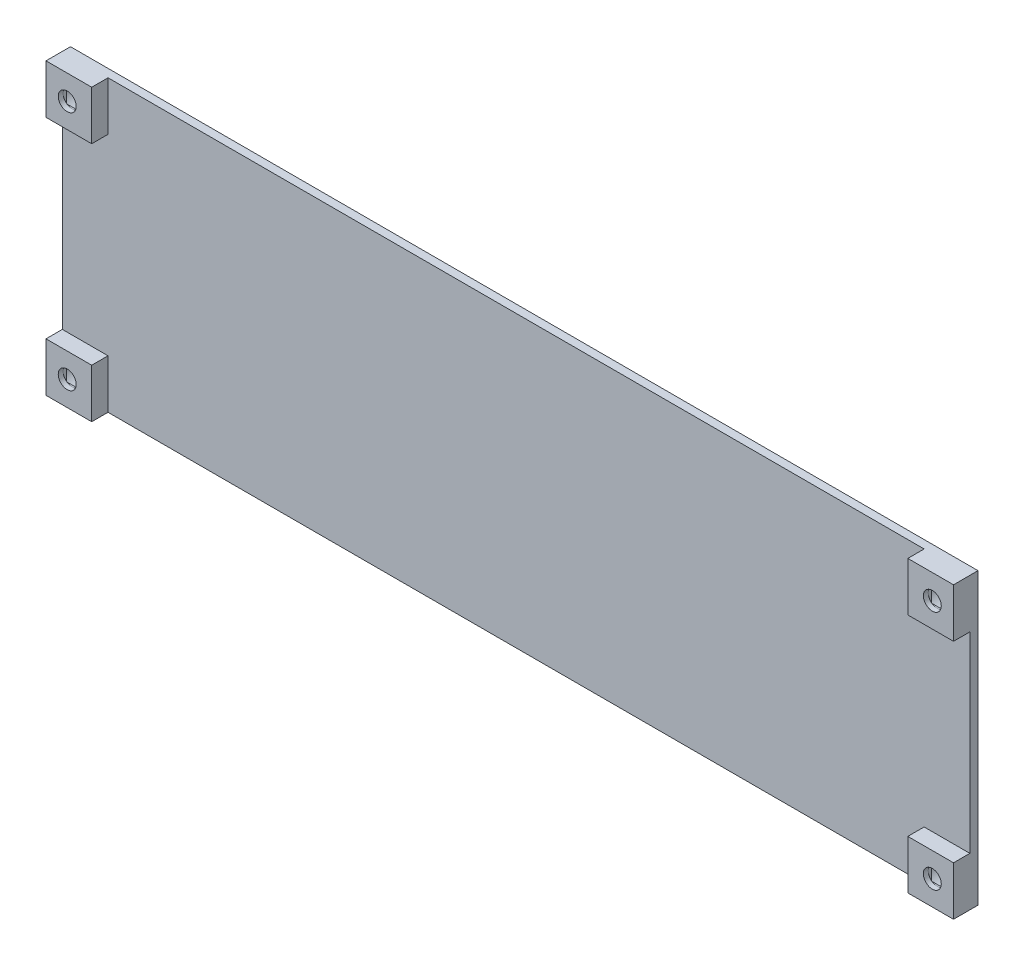
from build123d import *
from build123d.topology import SkipClean

# Parameters (mm, degrees)
SKETCH1_W               = 112
SKETCH1_H               = 35.5
BOSS_EXTRUDE1_DEPTH     = 1
SKETCH2_W               = 6
SKETCH2_H               = 6
BOSS_EXTRUDE2_DEPTH     = 2
SKETCH3_R               = 1.1
CUT_EXTRUDE1_DEPTH      = 59.822295943
SKETCH4_R               = 2
CUT_EXTRUDE2_DEPTH      = 2
CUT_EXTRUDE3_DEPTH      = 0.2
SKETCH6_W               = 2.2
SKETCH6_H               = 2.2
CUT_EXTRUDE4_DEPTH      = 0.2
MIRROR2_COPY_1_DEPTH    = 0.2
MIRROR2_COPY_2_SKETCH_W = 2.2
MIRROR2_COPY_2_SKETCH_H = 2.2
MIRROR2_COPY_2_DEPTH    = 0.2
SKETCH7_W               = 0.4
SKETCH7_H               = 35.5
CUT_EXTRUDE5_DEPTH      = 59.822295943
CUT_EXTRUDE6_DEPTH      = 0.2
BOSS_EXTRUDE3_DEPTH     = 0.2


with BuildPart() as part:
    # Sketch1 → Boss-Extrude1 (new body)
    with BuildSketch(Plane.XY):
        Rectangle(SKETCH1_W, SKETCH1_H)
    extrude(amount=BOSS_EXTRUDE1_DEPTH)

    # Sketch2 → Boss-Extrude2 (add)
    with BuildSketch(Plane.XY.offset(1)):
        with Locations((-53, 14.75)):
            Rectangle(SKETCH2_W, SKETCH2_H)
        with Locations((-53, -14.75)):
            Rectangle(SKETCH2_W, SKETCH2_H)
        with Locations((53, -14.75)):
            Rectangle(SKETCH2_W, SKETCH2_H)
        with Locations((53, 14.75)):
            Rectangle(SKETCH2_W, SKETCH2_H)
    extrude(amount=BOSS_EXTRUDE2_DEPTH)

    # Sketch3 → Cut-Extrude1 (cut, through all)
    with BuildSketch(Plane.XY.offset(3)):
        with Locations((-53, 14.75)):
            Circle(SKETCH3_R)
        with Locations(Location((-53, -14.75, 0), (0, 0, 180))):
            Circle(SKETCH3_R)
        with Locations((53, -14.75)):
            Circle(SKETCH3_R)
        with Locations(Location((53, 14.75, 0), (0, 0, 180))):
            Circle(SKETCH3_R)
    extrude(amount=-CUT_EXTRUDE1_DEPTH, mode=Mode.SUBTRACT)

    # Sketch4 → Cut-Extrude2 (cut)
    with BuildSketch(Plane(origin=(0, 0, 0), x_dir=(-1, 0, 0), z_dir=(0, 0, -1))):
        with Locations((-53, 14.75)):
            Circle(SKETCH4_R)
        with Locations((-53, -14.75)):
            Circle(SKETCH4_R)
        with Locations((53, 14.75)):
            Circle(SKETCH4_R)
        with Locations((53, -14.75)):
            Circle(SKETCH4_R)
    extrude(amount=-CUT_EXTRUDE2_DEPTH, mode=Mode.SUBTRACT)

    # Sketch5 → Cut-Extrude3 (cut)
    with SkipClean():  # the faces are left unmerged after this step: merging them gives an invalid solid
        with BuildSketch(Plane(origin=(0, 0, 2), x_dir=(-1, 0, 0), z_dir=(0, 0, -1))):
            with BuildLine():
                Line((-54.1, 13.079670691), (-54.1, 16.420329309))
                ThreePointArc((-54.1, 16.420329309), (-53, 16.75), (-51.9, 16.420329309))
                Line((-51.9, 16.420329309), (-51.9, 13.079670691))
                ThreePointArc((-51.9, 13.079670691), (-53, 12.75), (-54.1, 13.079670691))
            make_face()
        cut_extrude3 = extrude(amount=-CUT_EXTRUDE3_DEPTH, mode=Mode.SUBTRACT)

    # Sketch6 → Cut-Extrude4 (cut)
    with SkipClean():  # the faces are left unmerged after this step: merging them gives an invalid solid
        with BuildSketch(Plane(origin=(0, 0, 2.2), x_dir=(-1, 0, 0), z_dir=(0, 0, -1))):
            with Locations((-53, 14.75)):
                Rectangle(SKETCH6_W, SKETCH6_H)
        cut_extrude4 = extrude(amount=-CUT_EXTRUDE4_DEPTH, mode=Mode.SUBTRACT)

    # Mirror1: Cut-Extrude3, Cut-Extrude4 across plane
    with SkipClean():  # the faces are left unmerged after this step: merging them gives an invalid solid
        add(cut_extrude3.mirror(Plane(origin=(0, 0, 0), x_dir=(0, 0, 1), z_dir=(1, 0, 0))), mode=Mode.SUBTRACT)
        add(cut_extrude4.mirror(Plane(origin=(0, 0, 0), x_dir=(0, 0, 1), z_dir=(1, 0, 0))), mode=Mode.SUBTRACT)

    # Mirror2: Cut-Extrude3, Cut-Extrude4 across plane
    with SkipClean():  # the faces are left unmerged after this step: merging them gives an invalid solid
        add(cut_extrude3.mirror(Plane.ZX), mode=Mode.SUBTRACT)
        add(cut_extrude4.mirror(Plane.ZX), mode=Mode.SUBTRACT)

    # Mirror2 copy 1 sketch → Mirror2 copy 1 (cut)
    with SkipClean():  # the faces are left unmerged after this step: merging them gives an invalid solid
        with BuildSketch(Plane(origin=(0, 0, 2), x_dir=(1, 0, 0), z_dir=(0, 0, -1))):
            with BuildLine():
                Line((-54.1, 13.079670691), (-54.1, 16.420329309))
                ThreePointArc((-54.1, 16.420329309), (-53, 16.75), (-51.9, 16.420329309))
                Line((-51.9, 16.420329309), (-51.9, 13.079670691))
                ThreePointArc((-51.9, 13.079670691), (-53, 12.75), (-54.1, 13.079670691))
            make_face()
        extrude(amount=-MIRROR2_COPY_1_DEPTH, mode=Mode.SUBTRACT)

    # Mirror2 copy 2 sketch → Mirror2 copy 2 (cut)
    with SkipClean():  # the faces are left unmerged after this step: merging them gives an invalid solid
        with BuildSketch(Plane(origin=(0, 0, 2.2), x_dir=(1, 0, 0), z_dir=(0, 0, -1))):
            with Locations((-53, 14.75)):
                Rectangle(MIRROR2_COPY_2_SKETCH_W, MIRROR2_COPY_2_SKETCH_H)
        extrude(amount=-MIRROR2_COPY_2_DEPTH, mode=Mode.SUBTRACT)

    # Sketch7 → Cut-Extrude5 (cut, through all)
    with SkipClean():  # the faces are left unmerged after this step: merging them gives an invalid solid
        with BuildSketch(Plane(origin=(0, 0, 0), x_dir=(-1, 0, 0), z_dir=(0, 0, -1))):
            with Locations((-55.8, 0)):
                Rectangle(SKETCH7_W, SKETCH7_H)
            with Locations((55.8, 0)):
                Rectangle(SKETCH7_W, SKETCH7_H)
        extrude(amount=-CUT_EXTRUDE5_DEPTH, mode=Mode.SUBTRACT)

    # Sketch8 → Cut-Extrude6 (cut)
    with SkipClean():  # the faces are left unmerged after this step: merging them gives an invalid solid
        with BuildSketch(Plane(origin=(0, 0, 0), x_dir=(-1, 0, 0), z_dir=(0, 0, -1))):
            with BuildLine():
                add(Edge.make_bspline(
                    [(3.593304154, -0.141304348), (3.782621126, -0.21609679), (4.155384016, -0.363362229), (4.685515758, -0.626747088), (5.185947538, -0.905885584), (5.64762688, -1.218217721), (6.073537447, -1.556430019), (6.469205887, -1.917081418), (6.830733456, -2.303886675), (7.150261717, -2.721840268), (7.441647233, -3.159326761), (7.689864448, -3.625237823), (7.900251586, -4.116468632), (8.080229909, -4.630901051), (8.210614728, -5.174622397), (8.302766839, -5.742607998), (8.368405304, -6.33556514), (8.372329652, -6.740853659), (8.374331822, -6.947628458)],
                    knots=[0, 0, 0, 0, 1.093801908, 2.153683087, 3.179432455, 4.172254168, 5.14632992, 6.100828362, 7.048036701, 7.988159892, 8.92597937, 9.870901268, 10.821373797, 11.796609674, 12.797077128, 13.822443002, 14.889028699, 16, 16, 16, 16], degree=3))
                add(Edge.make_bspline(
                    [(8.374331822, -6.947628458), (8.369617098, -7.159874537), (8.360291338, -7.57969888), (8.300324817, -8.197806983), (8.194733728, -8.791293997), (8.048888883, -9.36040671), (7.869483952, -9.908234796), (7.640301957, -10.431799066), (7.36793305, -10.93042347), (6.954774121, -11.562312704), (6.359955282, -12.297521454), (5.509755968, -13.057132683), (4.559566498, -13.724773899), (3.493239771, -14.259339295), (2.346434991, -14.686639464), (1.130353153, -14.987624243), (-0.145194358, -15.1762545), (-1.015511649, -15.198139734), (-1.458869759, -15.209288538)],
                    knots=[0, 0, 0, 0, 0.707145738, 1.398739603, 2.066581228, 2.713453321, 3.354755146, 3.98497847, 4.614722218, 5.245394814, 6.49888604, 7.751849909, 9.032125326, 10.356849696, 11.71410182, 13.10173286, 14.52356117, 16, 16, 16, 16], degree=3))
                add(Edge.make_bspline(
                    [(-1.458869759, -15.209288538), (-1.744958781, -15.203813836), (-2.30713011, -15.193055926), (-3.136936656, -15.112782491), (-3.937602925, -14.987484913), (-4.712974644, -14.810073208), (-5.458395872, -14.578429489), (-6.176620953, -14.292772724), (-6.869796958, -13.964150927), (-7.525992313, -13.57472691), (-8.148937895, -13.144295978), (-8.72665093, -12.662492831), (-9.252519915, -12.127346527), (-9.736107162, -11.551722459), (-10.169120142, -10.929195989), (-10.551751326, -10.259832767), (-10.892323356, -9.544423924), (-11.076577635, -9.040960957), (-11.17033221, -8.784782609)],
                    knots=[0, 0, 0, 0, 1.098325863, 2.1582349, 3.198005682, 4.208194407, 5.209505907, 6.191929481, 7.173918982, 8.151711052, 9.118333295, 10.078630107, 11.035158777, 11.99545559, 12.962077833, 13.94243145, 14.953042137, 16, 16, 16, 16], degree=3))
                Line((-11.17033221, -8.784782609), (-6.771122724, -6.261462451))
                add(Edge.make_bspline(
                    [(-6.771122724, -6.261462451), (-6.662790789, -6.575499428), (-6.452733779, -7.184421148), (-5.986980422, -8.00331549), (-5.42677602, -8.707224356), (-4.76426148, -9.276785955), (-4.030664245, -9.721254951), (-3.247198887, -10.036969299), (-2.423045904, -10.243038616), (-1.856679743, -10.263132765), (-1.569541696, -10.273320158)],
                    knots=[0, 0, 0, 0, 1.126000664, 2.183329707, 3.181063205, 4.166811363, 5.133552749, 6.080305486, 7.026747408, 8, 8, 8, 8], degree=3))
                add(Edge.make_bspline(
                    [(-1.569541696, -10.273320158), (-1.293528292, -10.262916392), (-0.75674179, -10.242683312), (0.011774593, -10.04827643), (0.710218139, -9.735791902), (1.226651919, -9.373732968), (1.590117231, -9.028786808), (1.824580985, -8.739426974), (2.038466221, -8.434364103), (2.192448665, -8.093861), (2.323532377, -7.735710833), (2.416606971, -7.353641849), (2.473290352, -6.947502543), (2.478425897, -6.66929492), (2.481051189, -6.527075099)],
                    knots=[0, 0, 0, 0, 1.598918806, 3.109552001, 4.565636335, 6.017506463, 6.744131438, 7.466250292, 8.175648169, 8.898480383, 9.626286544, 10.386797627, 11.175330457, 12, 12, 12, 12], degree=3))
                add(Edge.make_bspline(
                    [(2.481051189, -6.527075099), (2.477784077, -6.369925321), (2.471443035, -6.064917989), (2.394446074, -5.626135359), (2.287153924, -5.215487733), (2.124480759, -4.835559265), (1.913602621, -4.485820511), (1.655210256, -4.166970362), (1.353161236, -3.878584621), (1.009833706, -3.613733827), (0.609443123, -3.397424598), (0.173538047, -3.195154574), (-0.310928832, -3.0307386), (-0.840724903, -2.89909922), (-1.417556197, -2.795200862), (-2.03998604, -2.718061406), (-2.708852681, -2.674845077), (-3.16869027, -2.668110322), (-3.406695846, -2.664624506)],
                    knots=[0, 0, 0, 0, 0.944462577, 1.833079328, 2.673167542, 3.49367128, 4.310262101, 5.123224284, 5.955282357, 6.818799209, 7.723285984, 8.686859241, 9.708272632, 10.795808816, 11.96921428, 13.232995045, 14.567836505, 16, 16, 16, 16], degree=3))
                Line((-3.406695846, -2.664624506), (-4.441478455, -2.664624506))
                Line((-4.441478455, -2.664624506), (-4.441478455, 1.92826087))
                Line((-4.441478455, 1.92826087), (-2.947407309, 1.92826087))
                add(Edge.make_bspline(
                    [(-2.947407309, 1.92826087), (-2.770200556, 1.931224892), (-2.426115345, 1.936980184), (-1.926768722, 1.987730452), (-1.459856241, 2.068580846), (-1.026322011, 2.187877679), (-0.618740583, 2.326750312), (-0.249070768, 2.513251024), (0.095177608, 2.721609727), (0.491655783, 3.053107658), (0.917893311, 3.512908516), (1.292609996, 4.147559623), (1.525862097, 4.850725208), (1.550078733, 5.344364395), (1.562474114, 5.597035573)],
                    knots=[0, 0, 0, 0, 0.975719931, 1.894571129, 2.761408257, 3.582009645, 4.369233952, 5.127953448, 5.858044713, 6.579962393, 7.967855396, 9.288498116, 10.612106997, 12, 12, 12, 12], degree=3))
                add(Edge.make_bspline(
                    [(1.562474114, 5.597035573), (1.551345735, 5.828826756), (1.529887253, 6.275781987), (1.348607061, 6.911017245), (1.043871718, 7.473784148), (0.616574254, 7.949100059), (0.103576147, 8.339578943), (-0.495765515, 8.613584334), (-1.163578233, 8.784001697), (-1.634862497, 8.802471115), (-1.879423119, 8.812055336)],
                    knots=[0, 0, 0, 0, 1.049106038, 2.022956289, 2.965771539, 3.925305, 4.898473145, 5.86721393, 6.893246548, 8, 8, 8, 8], degree=3))
                add(Edge.make_bspline(
                    [(-1.879423119, 8.812055336), (-2.146236804, 8.799551721), (-2.666992494, 8.775147692), (-3.421676425, 8.575004289), (-4.115309826, 8.236346809), (-4.751994036, 7.771570515), (-5.320160334, 7.180913011), (-5.817171816, 6.475092644), (-6.254085501, 5.662133996), (-6.470672893, 5.065370136), (-6.582980431, 4.755928854)],
                    knots=[0, 0, 0, 0, 0.958674045, 1.871099546, 2.785019286, 3.720572554, 4.691768083, 5.719060512, 6.81725941, 8, 8, 8, 8], degree=3))
                Line((-6.582980431, 4.755928854), (-10.788514028, 7.168577075))
                add(Edge.make_bspline(
                    [(-10.788514028, 7.168577075), (-10.702610749, 7.430337373), (-10.533734046, 7.944930257), (-10.207233495, 8.677026686), (-9.843858882, 9.364707002), (-9.434039168, 10.005780441), (-8.970889793, 10.593420757), (-8.46588835, 11.139799467), (-7.911890414, 11.637804023), (-7.31287544, 12.086465342), (-6.676197247, 12.482925665), (-6.011638779, 12.833532012), (-5.316033585, 13.129146414), (-4.590722923, 13.363485106), (-3.839256936, 13.555482677), (-3.058159077, 13.686164451), (-2.248095482, 13.764483886), (-1.698835122, 13.775589958), (-1.420134581, 13.781225296)],
                    knots=[0, 0, 0, 0, 1.069361373, 2.102250634, 3.108563351, 4.088233382, 5.052698257, 6.010756429, 6.974555926, 7.941677734, 8.913669322, 9.88460434, 10.857255703, 11.844986206, 12.842308434, 13.866941532, 14.917663476, 16, 16, 16, 16], degree=3))
                add(Edge.make_bspline(
                    [(-1.420134581, 13.781225296), (-0.993390697, 13.770030298), (-0.159791776, 13.748162055), (1.049119511, 13.563799794), (2.180185152, 13.258384634), (3.226323657, 12.835313493), (4.17504469, 12.296785661), (5.023739252, 11.66282296), (5.753080601, 10.920753444), (6.364972617, 10.085149366), (6.854883197, 9.169690853), (7.2072239, 8.178206435), (7.413420007, 7.118057649), (7.441457409, 6.389240524), (7.455754747, 6.017588933)],
                    knots=[0, 0, 0, 0, 1.159430369, 2.264824269, 3.314418978, 4.33759029, 5.323224119, 6.271782723, 7.207710299, 8.140274846, 9.077798985, 10.019723069, 10.990181423, 12, 12, 12, 12], degree=3))
                add(Edge.make_bspline(
                    [(7.455754747, 6.017588933), (7.444710845, 5.671836753), (7.423225669, 4.999198899), (7.23727836, 4.023955261), (6.926596178, 3.122491867), (6.497610949, 2.291853275), (5.945170486, 1.545932072), (5.275288053, 0.884297461), (4.489345527, 0.30687267), (3.897089049, 0.010641101), (3.593304154, -0.141304348)],
                    knots=[0, 0, 0, 0, 1.073985575, 2.089367457, 3.07209394, 4.028597903, 4.983795072, 5.944619371, 6.945737847, 8, 8, 8, 8], degree=3))
            make_face()
        extrude(amount=-CUT_EXTRUDE6_DEPTH, mode=Mode.SUBTRACT)

    # Sketch9 → Boss-Extrude3 (add)
    with SkipClean():  # the faces are left unmerged after this step: merging them gives an invalid solid
        with BuildSketch(Plane(origin=(0, 0, 0.2), x_dir=(-1, 0, 0), z_dir=(0, 0, -1))):
            with BuildLine():
                Line((-10.668089989, 7.214778894), (-6.63636072, 4.901839471))
                add(Edge.make_bspline(
                    [(-6.63636072, 4.901839471), (-6.540986999, 5.163734517), (-6.443619945, 5.424585358), (-6.21921805, 5.93074562), (-6.091732521, 6.175818947), (-5.809110478, 6.651480678), (-5.654705513, 6.882473941), (-5.310240971, 7.325696208), (-5.123968717, 7.532476038), (-4.718723675, 7.911492101), (-4.498048741, 8.084436055), (-4.02641518, 8.387281972), (-3.780304347, 8.514769135), (-3.26593731, 8.718250904), (-2.99495548, 8.794674098), (-2.440728382, 8.885822343), (-2.160269377, 8.899003862), (-1.87980642, 8.912147119)],
                    knots=[0, 0, 0, 0, 0.125, 0.125, 0.25, 0.25, 0.375, 0.375, 0.5, 0.5, 0.625, 0.625, 0.75, 0.75, 0.875, 0.875, 1, 1, 1, 1], degree=3))
                add(Edge.make_bspline(
                    [(-1.87980642, 8.912147119), (-1.652961864, 8.903257183), (-1.426128226, 8.894302905), (-0.979297658, 8.83610555), (-0.759519024, 8.785576049), (-0.326950308, 8.643333423), (-0.115369721, 8.552344409), (0.278174918, 8.328934489), (0.463297074, 8.193898114), (0.804020876, 7.888976286), (0.957539234, 7.722433619), (1.22261025, 7.354263586), (1.334223615, 7.150037354), (1.505441776, 6.729221403), (1.567157859, 6.510377203), (1.640619283, 6.055903453), (1.651575471, 5.826440772), (1.662591808, 5.596983285)],
                    knots=[0, 0, 0, 0, 0.125, 0.125, 0.25, 0.25, 0.375, 0.375, 0.5, 0.5, 0.625, 0.625, 0.75, 0.75, 0.875, 0.875, 1, 1, 1, 1], degree=3))
                add(Edge.make_bspline(
                    [(1.662591808, 5.596983285), (1.648911994, 5.31812984), (1.634665032, 5.039386092), (1.548674719, 4.633769223), (1.510214624, 4.500458465), (1.415424212, 4.237293403), (1.358671658, 4.106749496), (1.168643455, 3.732286718), (1.01403504, 3.501816943), (0.743270997, 3.182787921), (0.646202992, 3.080296989), (0.443198295, 2.885494812), (0.338250532, 2.792912459), (0.117386369, 2.623088423), (0.000505071, 2.547196239), (-0.241536666, 2.40699103), (-0.366536767, 2.340907666), (-0.621906427, 2.224609496), (-0.752326775, 2.175921442), (-1.016277411, 2.089301338), (-1.149440661, 2.050099851), (-1.553026634, 1.946662547), (-1.829890503, 1.900524456), (-2.3866785, 1.840484492), (-2.666532074, 1.832944901), (-2.946571049, 1.82826087)],
                    knots=[0, 0, 0, 0, 0.125, 0.125, 0.1875, 0.1875, 0.25, 0.25, 0.375, 0.375, 0.4375, 0.4375, 0.5, 0.5, 0.5625, 0.5625, 0.625, 0.625, 0.6875, 0.6875, 0.75, 0.75, 0.875, 0.875, 1, 1, 1, 1], degree=3))
                Line((-2.946571049, 1.82826087), (-4.341478455, 1.82826087))
                Line((-4.341478455, 1.82826087), (-4.341478455, -2.564624506))
                Line((-4.341478455, -2.564624506), (-3.405963588, -2.564624506))
                add(Edge.make_bspline(
                    [(-3.405963588, -2.564624506), (-3.069177587, -2.569557054), (-2.732513217, -2.575303236), (-2.063723763, -2.617160483), (-1.731416922, -2.652055711), (-1.071344093, -2.75222153), (-0.743412991, -2.816387614), (-0.256789545, -2.947911078), (-0.095476952, -2.997740695), (0.224619383, -3.114316288), (0.38241696, -3.181879681), (0.68908401, -3.328578944), (0.840172546, -3.405864574), (1.129857474, -3.582337535), (1.267194072, -3.6839556), (1.661264658, -4.018914116), (1.890365196, -4.271210232), (2.165243762, -4.70896855), (2.244267468, -4.86224835), (2.374024567, -5.177071172), (2.423863945, -5.340120451), (2.503675824, -5.673666685), (2.536060442, -5.843310811), (2.573764872, -6.183663611), (2.57750169, -6.35530297), (2.581070376, -6.526958601)],
                    knots=[0, 0, 0, 0, 0.125, 0.125, 0.25, 0.25, 0.375, 0.375, 0.4375, 0.4375, 0.5, 0.5, 0.5625, 0.5625, 0.625, 0.625, 0.75, 0.75, 0.8125, 0.8125, 0.875, 0.875, 0.9375, 0.9375, 1, 1, 1, 1], degree=3))
                add(Edge.make_bspline(
                    [(2.581070376, -6.526958601), (2.578613249, -6.660068386), (2.576121328, -6.793172326), (2.557554753, -7.057098424), (2.541036365, -7.187846039), (2.495169407, -7.447185908), (2.466064085, -7.575819026), (2.393550969, -7.83068257), (2.349410002, -7.957431159), (2.25092425, -8.205889424), (2.197743384, -8.327839191), (2.071066195, -8.559979842), (1.996329817, -8.669452965), (1.837099507, -8.882751396), (1.752784026, -8.987644587), (1.572571238, -9.183513857), (1.47653835, -9.274672448), (1.175274204, -9.533095498), (0.954602534, -9.686565424), (0.490899049, -9.945315336), (0.248332346, -10.051093218), (-0.255951259, -10.220475365), (-0.51603489, -10.282733138), (-1.039361036, -10.35334584), (-1.304391993, -10.36339689), (-1.569431075, -10.373387001)],
                    knots=[0, 0, 0, 0, 0.0625, 0.0625, 0.125, 0.125, 0.1875, 0.1875, 0.25, 0.25, 0.3125, 0.3125, 0.375, 0.375, 0.4375, 0.4375, 0.5, 0.5, 0.625, 0.625, 0.75, 0.75, 0.875, 0.875, 1, 1, 1, 1], degree=3))
                add(Edge.make_bspline(
                    [(-1.569431075, -10.373387001), (-1.865003347, -10.36290037), (-2.160538357, -10.352209452), (-2.740167258, -10.268100896), (-3.024461781, -10.195783232), (-3.585557719, -10.010066428), (-3.861934348, -9.895568595), (-4.383393179, -9.626532774), (-4.631394684, -9.471564642), (-5.101771543, -9.120454261), (-5.326355017, -8.921523636), (-5.729808654, -8.48960329), (-5.90988279, -8.25742651), (-6.235858996, -7.76748005), (-6.382264379, -7.507523152), (-6.6289052, -6.968071832), (-6.728992293, -6.688794514), (-6.826182967, -6.408326422)],
                    knots=[0, 0, 0, 0, 0.125, 0.125, 0.25, 0.25, 0.375, 0.375, 0.5, 0.5, 0.625, 0.625, 0.75, 0.75, 0.875, 0.875, 1, 1, 1, 1], degree=3))
                Line((-6.826182967, -6.408326422), (-11.047437948, -8.829574562))
                add(Edge.make_bspline(
                    [(-11.047437948, -8.829574562), (-10.95887463, -9.07118998), (-10.869210194, -9.312206137), (-10.668529824, -9.782618302), (-10.558132433, -10.012350941), (-10.202228863, -10.68810015), (-9.930420865, -11.119802455), (-9.456125295, -11.731119066), (-9.287921105, -11.928116614), (-8.939922484, -12.30412539), (-8.7589726, -12.483844218), (-8.190576284, -12.992547326), (-7.77788574, -13.291438893), (-7.123722328, -13.697901739), (-6.898298072, -13.826126503), (-6.439954147, -14.058560738), (-6.206812736, -14.164395892), (-5.498951603, -14.459834906), (-5.013969461, -14.622597737), (-4.015430409, -14.873387012), (-3.506718815, -14.96139167), (-2.74254786, -15.05071029), (-2.487015837, -15.073002787), (-1.973985885, -15.099395994), (-1.71657893, -15.104338547), (-1.459170179, -15.10926448)],
                    knots=[0, 0, 0, 0, 0.0625, 0.0625, 0.125, 0.125, 0.25, 0.25, 0.3125, 0.3125, 0.375, 0.375, 0.5, 0.5, 0.5625, 0.5625, 0.625, 0.625, 0.75, 0.75, 0.875, 0.875, 0.9375, 0.9375, 1, 1, 1, 1], degree=3))
                add(Edge.make_bspline(
                    [(-1.459170179, -15.10926448), (-1.161778522, -15.101786138), (-0.864390475, -15.094286047), (-0.27236703, -15.062700161), (0.022055197, -15.037329947), (0.899117552, -14.923835998), (1.476945739, -14.806718612), (2.618144095, -14.485369093), (3.1837039, -14.275132359), (3.989539476, -13.896584175), (4.514221481, -13.621226631), (5.006675547, -13.286787241), (5.48505027, -12.926536902), (5.716647994, -12.734939108), (6.152418423, -12.331796297), (6.356909661, -12.118565003), (6.737896347, -11.667731174), (6.91529273, -11.430912933), (7.24569829, -10.936046599), (7.398913487, -10.674956815), (7.663783467, -10.140915203), (7.775400995, -9.866913712), (7.959893485, -9.305919251), (8.036730995, -9.020255035), (8.15957849, -8.43858926), (8.204574102, -8.141051838), (8.259762854, -7.545463869), (8.267673046, -7.246277583), (8.274321068, -6.947002021)],
                    knots=[0, 0, 0, 0, 0.0625, 0.0625, 0.125, 0.125, 0.25, 0.25, 0.375, 0.375, 0.4375, 0.5, 0.5, 0.5625, 0.5625, 0.625, 0.625, 0.6875, 0.6875, 0.75, 0.75, 0.8125, 0.8125, 0.875, 0.875, 0.9375, 0.9375, 1, 1, 1, 1], degree=3))
                add(Edge.make_bspline(
                    [(8.274321068, -6.947002021), (8.272493991, -6.758316523), (8.270651737, -6.569633361), (8.250692317, -6.194772227), (8.231730017, -6.008724345), (8.159566381, -5.452932242), (8.09474304, -5.084976989), (7.941964263, -4.541593936), (7.880568143, -4.361203737), (7.744894286, -4.007552938), (7.671027238, -3.834043415), (7.508129985, -3.495362374), (7.419079896, -3.330201789), (7.223263871, -3.009622312), (7.117002038, -2.853926219), (6.892937196, -2.548880363), (6.773690347, -2.399850387), (6.521985288, -2.118870339), (6.389721757, -1.98546897), (5.977938214, -1.60184259), (5.684884886, -1.366581389), (5.057446036, -0.941760058), (4.726792203, -0.759274105), (4.220500813, -0.509861709), (4.048596263, -0.433128445), (3.699811941, -0.289806712), (3.523833683, -0.221379999), (3.34830572, -0.152035107)],
                    knots=[0, 0, 0, 0, 0.0625, 0.0625, 0.125, 0.125, 0.25, 0.25, 0.3125, 0.3125, 0.375, 0.375, 0.4375, 0.4375, 0.5, 0.5, 0.5625, 0.5625, 0.625, 0.625, 0.75, 0.75, 0.875, 0.875, 0.9375, 0.9375, 1, 1, 1, 1], degree=3))
                add(Edge.make_bspline(
                    [(3.34830572, -0.152035107), (3.639517868, -0.006378225), (3.932823027, 0.136335741), (4.49700383, 0.453301097), (4.764856808, 0.631802561), (5.270103173, 1.031633742), (5.508753374, 1.251196296), (5.843086597, 1.613782494), (5.950588933, 1.740537291), (6.152225712, 1.999873787), (6.247045525, 2.133123497), (6.513401312, 2.543681447), (6.666569958, 2.831955938), (6.928869422, 3.434797794), (7.037124453, 3.748411339), (7.204245843, 4.380904989), (7.264259798, 4.702243442), (7.334474275, 5.355691748), (7.345147078, 5.687100231), (7.355693326, 6.017262736)],
                    knots=[0, 0, 0, 0, 0.125, 0.125, 0.25, 0.25, 0.375, 0.375, 0.4375, 0.4375, 0.5, 0.5, 0.625, 0.625, 0.75, 0.75, 0.875, 0.875, 1, 1, 1, 1], degree=3))
                add(Edge.make_bspline(
                    [(7.355693326, 6.017262736), (7.345190318, 6.290277208), (7.334642966, 6.563284143), (7.290363763, 7.105358071), (7.254929328, 7.374135727), (7.151359681, 7.906133912), (7.084166281, 8.169514491), (6.917638926, 8.690813723), (6.81775028, 8.949356255), (6.476843218, 9.694572684), (6.194445676, 10.159292778), (5.690421766, 10.809553223), (5.508632346, 11.017810354), (5.126126154, 11.406799226), (4.924154113, 11.588766319), (4.287101261, 12.098277777), (3.819368469, 12.395472441), (2.84686523, 12.891321184), (2.339139702, 13.089552107), (1.286927938, 13.400944834), (0.751015376, 13.512399547), (-0.327885663, 13.65003516), (-0.874000594, 13.666863755), (-1.420435172, 13.681198778)],
                    knots=[0, 0, 0, 0, 0.0625, 0.0625, 0.125, 0.125, 0.1875, 0.1875, 0.25, 0.25, 0.375, 0.375, 0.4375, 0.4375, 0.5, 0.5, 0.625, 0.625, 0.75, 0.75, 0.875, 0.875, 1, 1, 1, 1], degree=3))
                add(Edge.make_bspline(
                    [(-1.420435172, 13.681198778), (-1.674501435, 13.67606147), (-1.92856327, 13.670896833), (-2.434036426, 13.644214518), (-2.685345911, 13.622068531), (-3.435223863, 13.530639907), (-3.929447136, 13.434548439), (-4.90548814, 13.165826209), (-5.391419487, 12.997090772), (-6.310885025, 12.575942263), (-6.750835419, 12.329404741), (-7.592618348, 11.767033528), (-7.99396579, 11.444403384), (-8.535669991, 10.916299749), (-8.707134743, 10.732224004), (-9.034794312, 10.350584175), (-9.191100102, 10.153118116), (-9.631275728, 9.535331593), (-9.886135037, 9.088340152), (-10.219320793, 8.403650868), (-10.322869816, 8.172055819), (-10.507663598, 7.698874859), (-10.588437516, 7.457078043), (-10.668089989, 7.214778894)],
                    knots=[0, 0, 0, 0, 0.0625, 0.0625, 0.125, 0.125, 0.25, 0.25, 0.375, 0.375, 0.5, 0.5, 0.625, 0.625, 0.6875, 0.6875, 0.75, 0.75, 0.875, 0.875, 0.9375, 0.9375, 1, 1, 1, 1], degree=3))
            make_face()
        extrude(amount=BOSS_EXTRUDE3_DEPTH)


solid = part.part
